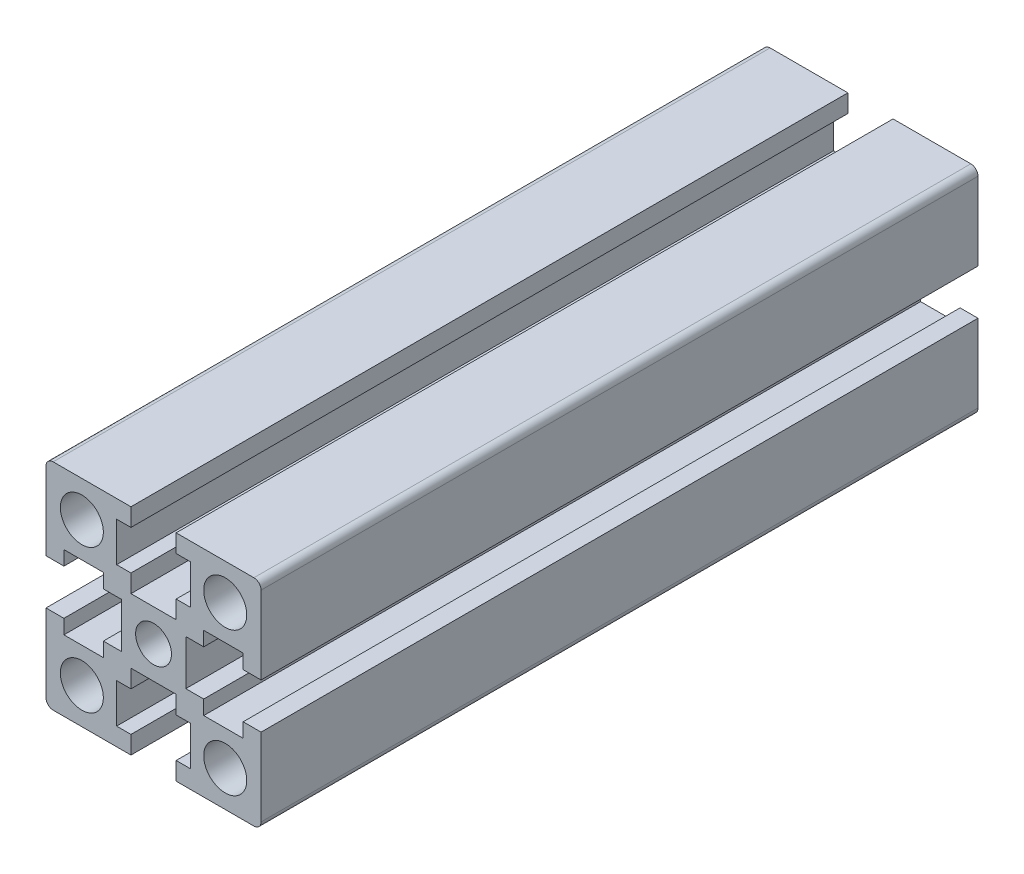
from build123d import *

# Parameters (mm, degrees)
SKETCH_1_R      = 3
SKETCH_1_R_2    = 2.5
EXTRUDE_1_DEPTH = 100


with BuildPart() as part:
    # 草图1 → 凸台-拉伸1 (new body)
    with BuildSketch(Plane.XY):
        with BuildLine():
            Line((-11.436512183, -15.117205795), (-11.436512183, -4.267205795))
            Line((-11.436512183, -4.267205795), (-8.936512183, -4.267205795))
            Line((-8.936512183, -4.267205795), (-8.936512183, -6.267205795))
            Line((-8.936512183, -6.267205795), (-3.436512183, -6.267205795))
            Line((-3.436512183, -6.267205795), (-3.436512183, -4.267205795))
            Line((-3.436512183, -4.267205795), (-0.936512183, -4.267205795))
            Line((-0.936512183, -4.267205795), (-0.936512183, 2.032794205))
            Line((-0.936512183, 2.032794205), (-3.436512183, 2.032794205))
            Line((-3.436512183, 2.032794205), (-3.436512183, 4.032794205))
            Line((-3.436512183, 4.032794205), (-8.936512183, 4.032794205))
            Line((-8.936512183, 4.032794205), (-8.936512183, 2.032794205))
            Line((-8.936512183, 2.032794205), (-11.436512183, 2.032794205))
            Line((-11.436512183, 2.032794205), (-11.436512183, 12.882794205))
            ThreePointArc((-11.436512183, 12.882794205), (-11.143618964, 13.589900986), (-10.436512183, 13.882794205))
            Line((-10.436512183, 13.882794205), (0.413487817, 13.882794205))
            Line((0.413487817, 13.882794205), (0.413487817, 11.382794205))
            Line((0.413487817, 11.382794205), (-1.586512183, 11.382794205))
            Line((-1.586512183, 11.382794205), (-1.586512183, 5.882794205))
            Line((-1.586512183, 5.882794205), (0.413487817, 5.882794205))
            Line((0.413487817, 5.882794205), (0.413487817, 3.382794205))
            Line((0.413487817, 3.382794205), (6.713487817, 3.382794205))
            Line((6.713487817, 3.382794205), (6.713487817, 5.882794205))
            Line((6.713487817, 5.882794205), (8.713487817, 5.882794205))
            Line((8.713487817, 5.882794205), (8.713487817, 11.382794205))
            Line((8.713487817, 11.382794205), (6.713487817, 11.382794205))
            Line((6.713487817, 11.382794205), (6.713487817, 13.882794205))
            Line((6.713487817, 13.882794205), (17.563487817, 13.882794205))
            ThreePointArc((17.563487817, 13.882794205), (18.270594598, 13.589900986), (18.563487817, 12.882794205))
            Line((18.563487817, 12.882794205), (18.563487817, 2.032794205))
            Line((18.563487817, 2.032794205), (16.063487817, 2.032794205))
            Line((16.063487817, 2.032794205), (16.063487817, 4.032794205))
            Line((16.063487817, 4.032794205), (10.563487817, 4.032794205))
            Line((10.563487817, 4.032794205), (10.563487817, 2.032794205))
            Line((10.563487817, 2.032794205), (8.063487817, 2.032794205))
            Line((8.063487817, 2.032794205), (8.063487817, -4.267205795))
            Line((8.063487817, -4.267205795), (10.563487817, -4.267205795))
            Line((10.563487817, -4.267205795), (10.563487817, -6.267205795))
            Line((10.563487817, -6.267205795), (16.063487817, -6.267205795))
            Line((16.063487817, -6.267205795), (16.063487817, -4.267205795))
            Line((16.063487817, -4.267205795), (18.563487817, -4.267205795))
            Line((18.563487817, -4.267205795), (18.563487817, -15.117205795))
            ThreePointArc((18.563487817, -15.117205795), (18.270594598, -15.824312576), (17.563487817, -16.117205795))
            Line((17.563487817, -16.117205795), (6.713487817, -16.117205795))
            Line((6.713487817, -16.117205795), (6.713487817, -13.617205795))
            Line((6.713487817, -13.617205795), (8.713487817, -13.617205795))
            Line((8.713487817, -13.617205795), (8.713487817, -8.117205795))
            Line((8.713487817, -8.117205795), (6.713487817, -8.117205795))
            Line((6.713487817, -8.117205795), (6.713487817, -5.617205795))
            Line((6.713487817, -5.617205795), (0.413487817, -5.617205795))
            Line((0.413487817, -5.617205795), (0.413487817, -8.117205795))
            Line((0.413487817, -8.117205795), (-1.586512183, -8.117205795))
            Line((-1.586512183, -8.117205795), (-1.586512183, -13.617205795))
            Line((-1.586512183, -13.617205795), (0.413487817, -13.617205795))
            Line((0.413487817, -13.617205795), (0.413487817, -16.117205795))
            Line((0.413487817, -16.117205795), (-10.436512183, -16.117205795))
            ThreePointArc((-10.436512183, -16.117205795), (-11.143618964, -15.824312576), (-11.436512183, -15.117205795))
        make_face()
        with Locations((-6.436512183, 8.882794205)):
            Circle(SKETCH_1_R, mode=Mode.SUBTRACT)
        with Locations((-6.436512183, -11.117205795)):
            Circle(SKETCH_1_R, mode=Mode.SUBTRACT)
        with Locations((13.563487817, -11.117205795)):
            Circle(SKETCH_1_R, mode=Mode.SUBTRACT)
        with Locations((13.563487817, 8.882794205)):
            Circle(SKETCH_1_R, mode=Mode.SUBTRACT)
        with Locations((3.563487817, -1.117205795)):
            Circle(SKETCH_1_R_2, mode=Mode.SUBTRACT)
    extrude(amount=EXTRUDE_1_DEPTH)


solid = part.part
